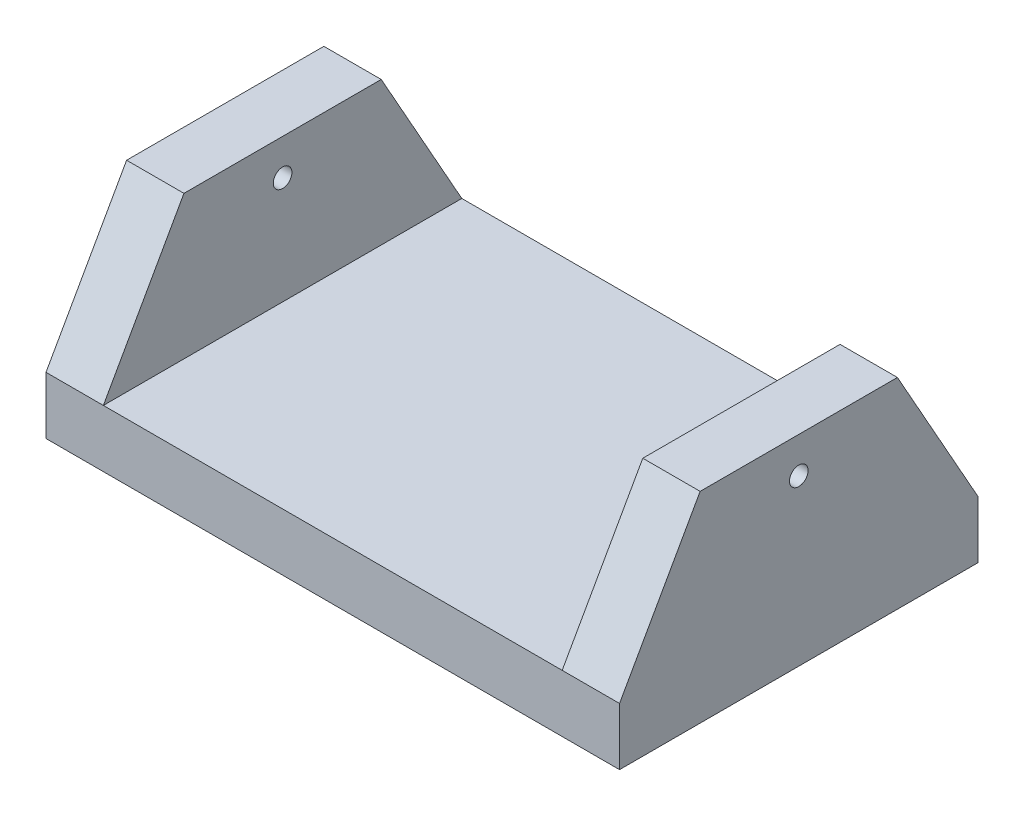
from build123d import *

# Parameters (mm, degrees)
SKETCH2_W           = 80
SKETCH2_H           = 50
BOSS_EXTRUDE1_DEPTH = 8
SKETCH3_R           = 1.3
BOSS_EXTRUDE2_DEPTH = 8


with BuildPart() as part:
    # Sketch2 → Boss-Extrude1 (new body)
    with BuildSketch(Plane(origin=(0, 0, 0), x_dir=(1, 0, 0), z_dir=(0, 1, 0))):
        Rectangle(SKETCH2_W, SKETCH2_H)
    extrude(amount=BOSS_EXTRUDE1_DEPTH)

    # Sketch3 → Boss-Extrude2 (add)
    with BuildSketch(Plane(origin=(40, 0, 0), x_dir=(0, 0, -1), z_dir=(1, 0, 0))):
        Polygon((13.758286246, 28), (25, 8), (-25, 8), (-13.758286246, 28), align=None)
        with Locations((0, 23)):
            Circle(SKETCH3_R, mode=Mode.SUBTRACT)
    boss_extrude2 = extrude(amount=-BOSS_EXTRUDE2_DEPTH)

    # Mirror1: Boss-Extrude2 across plane
    add(boss_extrude2.mirror(Plane(origin=(0, 0, 0), x_dir=(0, 0, 1), z_dir=(1, 0, 0))))


solid = part.part
